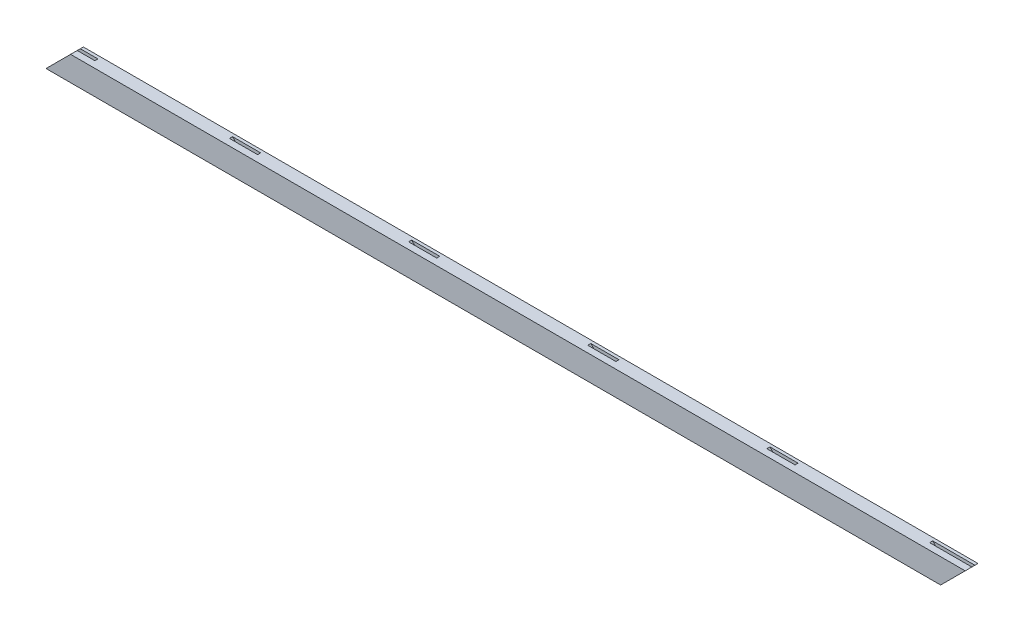
from build123d import *

# Parameters (mm, degrees)
EXTRUDE_1_DEPTH        = 25
CUT_EXTRUDE_START      = -6
CUT_EXTRUDE_1_DEPTH    = 6
PATTERN_LINEAR_1_COUNT = 4
PATTERN_LINEAR_1_PITCH = 350
MIRROR_START           = -6
MIRROR_1_COPY_1_DEPTH  = 6
MIRROR_1_COPY_2_DEPTH  = 6
MIRROR_1_COPY_3_DEPTH  = 6
CUT_EXTRUDE_START_2    = -13
CUT_EXTRUDE_2_DEPTH    = 6


with BuildPart() as part:
    # 草图2 → 凸台-拉伸1 (new body)
    with BuildSketch(Plane.XY):
        Polygon((0, 0), (-48, -48), (1700, -48), (1748, 0), align=None)
    extrude(amount=EXTRUDE_1_DEPTH)

    # 草图3 → 切除-拉伸1 (cut)
    with BuildSketch(Plane(origin=(0, 0, 0), x_dir=(-1, 0, 0), z_dir=(0, 0, -1)).offset(CUT_EXTRUDE_START)):
        Polygon((-1402.5, 0), (-1395, -7.5), (-1355, -7.5), (-1347.5, 0), align=None)
    cut_extrude_1 = extrude(amount=-CUT_EXTRUDE_1_DEPTH, mode=Mode.SUBTRACT)

    # 阵列(线性)1: 切除-拉伸1 ×4
    with Locations(*[(-i * PATTERN_LINEAR_1_PITCH, 0, 0) for i in range(1, PATTERN_LINEAR_1_COUNT)]):
        add(cut_extrude_1, mode=Mode.SUBTRACT)

    # 镜向1: 切除-拉伸1 across plane
    add(cut_extrude_1.mirror(Plane.ZX.offset(-24)), mode=Mode.SUBTRACT)

    # 镜向1 copy 1 sketch → 镜向1 copy 1 (cut)
    with BuildSketch(Plane(origin=(-350, -48, 0), x_dir=(-1, 0, 0), z_dir=(0, 0, -1)).offset(MIRROR_START)):
        Polygon((-1402.5, 0), (-1395, 7.5), (-1355, 7.5), (-1347.5, 0), align=None)
    extrude(amount=-MIRROR_1_COPY_1_DEPTH, mode=Mode.SUBTRACT)

    # 镜向1 copy 2 sketch → 镜向1 copy 2 (cut)
    with BuildSketch(Plane(origin=(-700, -48, 0), x_dir=(-1, 0, 0), z_dir=(0, 0, -1)).offset(MIRROR_START)):
        Polygon((-1402.5, 0), (-1395, 7.5), (-1355, 7.5), (-1347.5, 0), align=None)
    extrude(amount=-MIRROR_1_COPY_2_DEPTH, mode=Mode.SUBTRACT)

    # 镜向1 copy 3 sketch → 镜向1 copy 3 (cut)
    with BuildSketch(Plane(origin=(-1050, -48, 0), x_dir=(-1, 0, 0), z_dir=(0, 0, -1)).offset(MIRROR_START)):
        Polygon((-1402.5, 0), (-1395, 7.5), (-1355, 7.5), (-1347.5, 0), align=None)
    extrude(amount=-MIRROR_1_COPY_3_DEPTH, mode=Mode.SUBTRACT)

    # 草图4 → 切除-拉伸2 (cut)
    with BuildSketch(Plane.XY.offset(25).offset(CUT_EXTRUDE_START_2)):
        Polygon((1665.5, 0), (1673, -7.5), (1740.5, -7.5), (1748, 0), align=None)
        Polygon((1665.5, -48), (1673, -40.5), (1707.5, -40.5), (1700, -48), align=None)
        Polygon((34.5, -48), (27, -40.5), (-40.5, -40.5), (-48, -48), align=None)
        Polygon((34.5, 0), (27, -7.5), (-7.5, -7.5), (0, 0), align=None)
    extrude(amount=-CUT_EXTRUDE_2_DEPTH, mode=Mode.SUBTRACT)


solid = part.part
